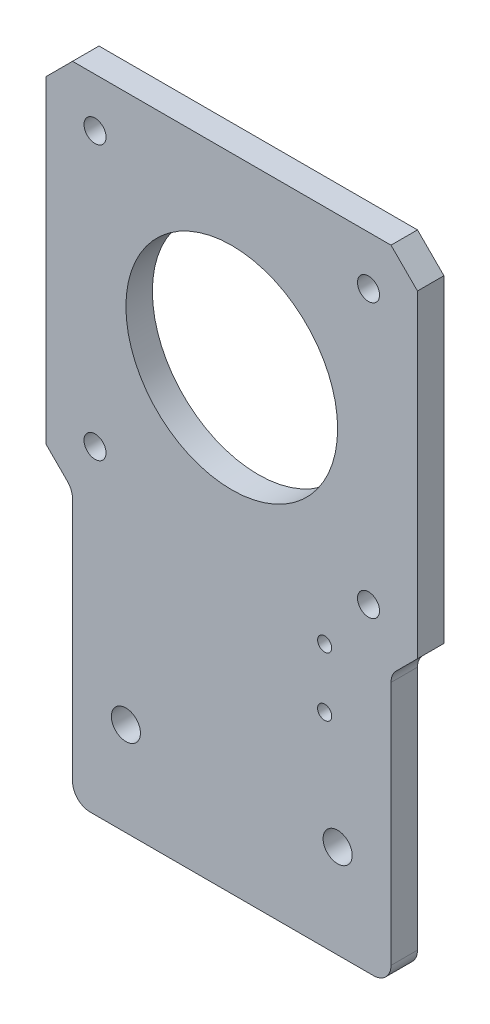
from build123d import *

# Parameters (mm, degrees)
SKETCH1_R                   = 12
BOSS_EXTRUDE1_DEPTH         = 3
TAP_DRILL_FOR_M3_TAP1_D     = 2.5
TAP_DRILL_FOR_M3_TAP1_DEPTH = 5
TAP_DRILL_FOR_M3_TAP1_TIP   = 0.751075774
TAP_DRILL_FOR_M4_TAP1_D     = 3.3
TAP_DRILL_FOR_M4_TAP1_DEPTH = 5
TAP_DRILL_FOR_M4_TAP1_TIP   = 0.991420021
FILLET1_R                   = 2
TAP_DRILL_FOR_M2_TAP1_D     = 1.6
TAP_DRILL_FOR_M2_TAP1_DEPTH = 5
TAP_DRILL_FOR_M2_TAP1_TIP   = 0.480688495


with BuildPart() as part:
    # Sketch1 → Boss-Extrude1 (new body)
    with BuildSketch(Plane.XY):
        Polygon((18.05, -51.655), (18.05, -21.05), (21.05, -18.05), (21.05, 18.05), (18.05, 21.05), (-18.05, 21.05), (-21.05, 18.05), (-21.05, -18.05), (-18.05, -21.05), (-18.05, -51.655), align=None)
        Circle(SKETCH1_R, mode=Mode.SUBTRACT)
    extrude(amount=BOSS_EXTRUDE1_DEPTH)

    # Tap Drill for M3 Tap1
    with Locations(Plane.XY.offset(3)):
        with Locations((-15.5, 15.5), (15.5, 15.5), (-15.5, -15.5), (15.5, -15.5)):
            Hole(TAP_DRILL_FOR_M3_TAP1_D / 2, depth=TAP_DRILL_FOR_M3_TAP1_DEPTH)
            with Locations((0, 0, -(TAP_DRILL_FOR_M3_TAP1_DEPTH + TAP_DRILL_FOR_M3_TAP1_TIP / 2))):  # 118° drill point
                Cone(0, TAP_DRILL_FOR_M3_TAP1_D / 2, TAP_DRILL_FOR_M3_TAP1_TIP, mode=Mode.SUBTRACT)

    # Tap Drill for M4 Tap1
    with Locations(Plane.XY.offset(3)):
        with Locations((-12, -41.055), (12, -41.055)):
            Hole(TAP_DRILL_FOR_M4_TAP1_D / 2, depth=TAP_DRILL_FOR_M4_TAP1_DEPTH)
            with Locations((0, 0, -(TAP_DRILL_FOR_M4_TAP1_DEPTH + TAP_DRILL_FOR_M4_TAP1_TIP / 2))):  # 118° drill point
                Cone(0, TAP_DRILL_FOR_M4_TAP1_D / 2, TAP_DRILL_FOR_M4_TAP1_TIP, mode=Mode.SUBTRACT)

    # Fillet1
    fillet1_edges = [part.edges().sort_by_distance(p)[0] for p in [
        (18.05, -21.05, 1.5),
        (18.05, -51.655, 1.5),
        (-18.05, -51.655, 1.5),
        (-18.05, -21.05, 1.5),
    ]]
    fillet(fillet1_edges, radius=FILLET1_R)

    # Tap Drill for M2 Tap1
    with Locations(Plane.XY.offset(3)):
        with Locations((10.52945603, -21.86131015), (10.52945603, -28.56131015)):
            Hole(TAP_DRILL_FOR_M2_TAP1_D / 2, depth=TAP_DRILL_FOR_M2_TAP1_DEPTH)
            with Locations((0, 0, -(TAP_DRILL_FOR_M2_TAP1_DEPTH + TAP_DRILL_FOR_M2_TAP1_TIP / 2))):  # 118° drill point
                Cone(0, TAP_DRILL_FOR_M2_TAP1_D / 2, TAP_DRILL_FOR_M2_TAP1_TIP, mode=Mode.SUBTRACT)


solid = part.part
